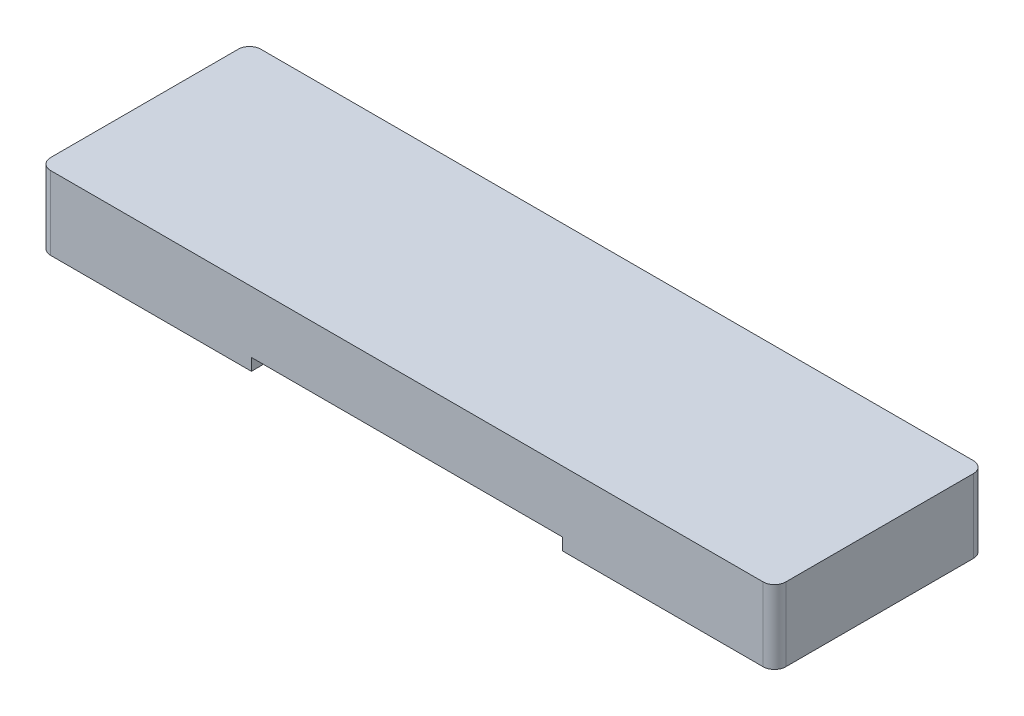
from build123d import *

# Parameters (mm, degrees)
SKETCH1_W           = 130
SKETCH1_H           = 13
BOSS_EXTRUDE1_DEPTH = 37.17
SHELL1_T            = -2
SKETCH2_W           = 55
SKETCH2_H           = 2.13378228
CUT_EXTRUDE1_DEPTH  = 5
FILLET1_R           = 2


with BuildPart() as part:
    # Sketch1 → Boss-Extrude1 (new body)
    with BuildSketch(Plane.XY):
        with Locations((65, 6.5)):
            Rectangle(SKETCH1_W, SKETCH1_H)
    extrude(amount=-BOSS_EXTRUDE1_DEPTH)

    # Shell1
    shell1_openings = [part.faces().sort_by_distance(p)[0] for p in [
        (65, 0, -18.585),
    ]]
    offset(amount=SHELL1_T, openings=shell1_openings, kind=Kind.INTERSECTION)

    # Sketch2 → Cut-Extrude1 (cut)
    with BuildSketch(Plane.XY):
        with Locations((65, 1.06689114)):
            Rectangle(SKETCH2_W, SKETCH2_H)
    extrude(amount=-CUT_EXTRUDE1_DEPTH, mode=Mode.SUBTRACT)

    # Fillet1
    fillet1_edges = [part.edges().sort_by_distance(p)[0] for p in [
        (130, 6.5, -37.17),
        (0, 6.5, -37.17),
        (130, 6.5, 0),
        (0, 6.5, 0),
    ]]
    fillet(fillet1_edges, radius=FILLET1_R)


solid = part.part
